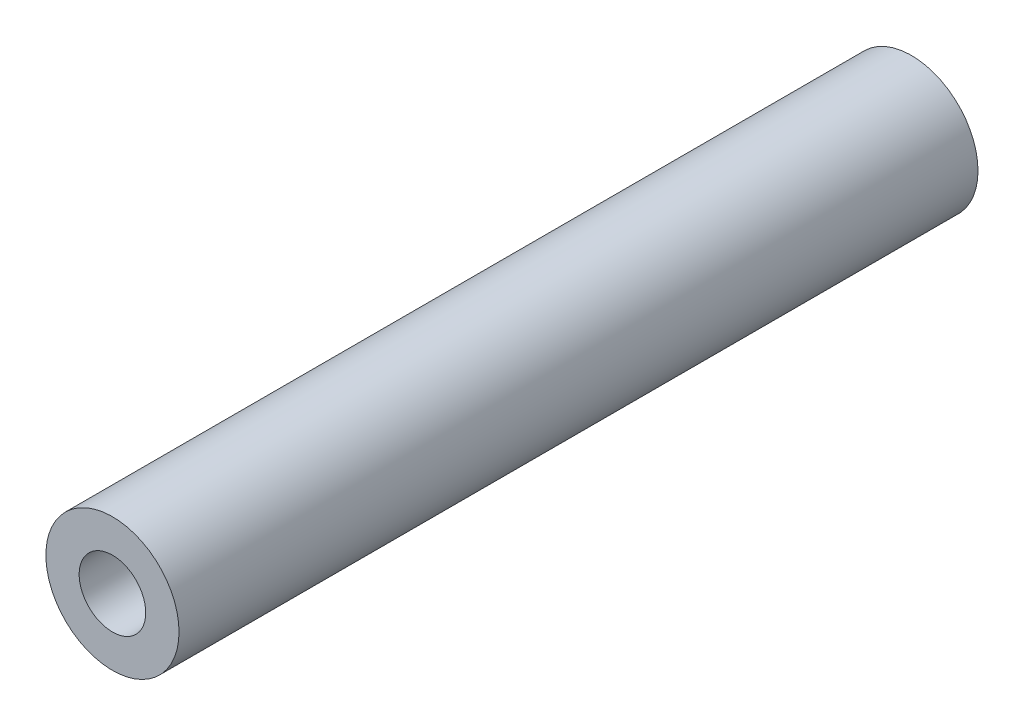
from build123d import *

# Parameters (mm, degrees)
SKETCH1_R           = 5
SKETCH1_R_2         = 2.5
BOSS_EXTRUDE1_DEPTH = 60


with BuildPart() as part:
    # Sketch1 → Boss-Extrude1 (new body)
    with BuildSketch(Plane.XY):
        Circle(SKETCH1_R)
        Circle(SKETCH1_R_2, mode=Mode.SUBTRACT)
    extrude(amount=BOSS_EXTRUDE1_DEPTH)


solid = part.part
